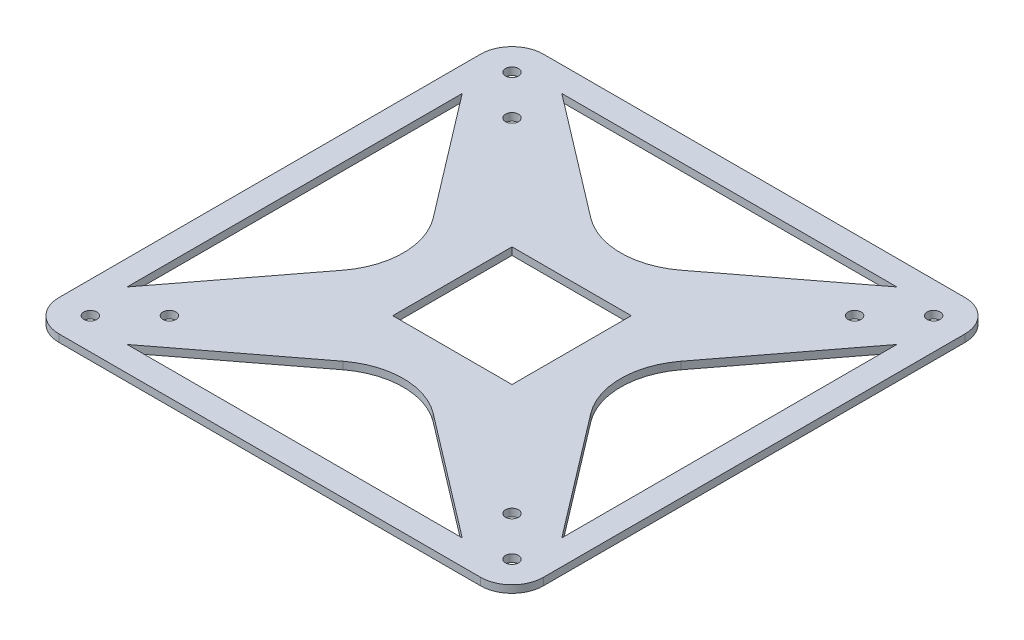
from build123d import *

# Parameters (mm, degrees)
SKETCH_1_R      = 1.75
SKETCH_1_W      = 32
SKETCH_1_H      = 32
EXTRUDE_1_DEPTH = 2


with BuildPart() as part:
    # 草图1 → 凸台-拉伸1 (new body)
    with BuildSketch(Plane(origin=(0, 0, 0), x_dir=(1, 0, 0), z_dir=(0, 1, 0))):
        with BuildLine():
            Line((-56.568542495, 65), (56.568542495, 65))
            ThreePointArc((56.568542495, 65), (62.530483272, 62.530483272), (65, 56.568542495))
            Line((65, 56.568542495), (65, -56.568542495))
            ThreePointArc((65, -56.568542495), (62.530483272, -62.530483272), (56.568542495, -65))
            Line((56.568542495, -65), (-56.568542495, -65))
            ThreePointArc((-56.568542495, -65), (-62.530483272, -62.530483272), (-65, -56.568542495))
            Line((-65, -56.568542495), (-65, 56.568542495))
            ThreePointArc((-65, 56.568542495), (-62.530483272, 62.530483272), (-56.568542495, 65))
        make_face()
        with Locations(Location((-56.568542495, 56.568542495, 0), (0, 0, 270))):
            Circle(SKETCH_1_R, mode=Mode.SUBTRACT)
        with Locations(Location((56.568542495, 56.568542495, 0), (0, 0, 270))):
            Circle(SKETCH_1_R, mode=Mode.SUBTRACT)
        with Locations(Location((56.568542495, -56.568542495, 0), (0, 0, 270))):
            Circle(SKETCH_1_R, mode=Mode.SUBTRACT)
        with Locations(Location((-56.568542495, -56.568542495, 0), (0, 0, 270))):
            Circle(SKETCH_1_R, mode=Mode.SUBTRACT)
        with Locations(Location((45.961940777, 45.961940777, 0), (0, 0, 270))):
            Circle(SKETCH_1_R, mode=Mode.SUBTRACT)
        with Locations(Location((45.961940777, -45.961940777, 0), (0, 0, 270))):
            Circle(SKETCH_1_R, mode=Mode.SUBTRACT)
        with Locations(Location((-45.961940777, -45.961940777, 0), (0, 0, 270))):
            Circle(SKETCH_1_R, mode=Mode.SUBTRACT)
        with Locations(Location((-45.961940777, 45.961940777, 0), (0, 0, 270))):
            Circle(SKETCH_1_R, mode=Mode.SUBTRACT)
        with BuildLine():
            Line((-12.13091169, 33.271867745), (-44.961628787, 58.318542495))
            Line((-44.961628787, 58.318542495), (44.961628787, 58.318542495))
            Line((44.961628787, 58.318542495), (12.13091169, 33.271867745))
            ThreePointArc((12.13091169, 33.271867745), (0, 29.172841978), (-12.13091169, 33.271867745))
        make_face(mode=Mode.SUBTRACT)
        with BuildLine():
            Line((33.271867745, 12.13091169), (58.318542495, 44.961628787))
            Line((58.318542495, 44.961628787), (58.318542495, -44.961628787))
            Line((58.318542495, -44.961628787), (33.271867745, -12.13091169))
            ThreePointArc((33.271867745, -12.13091169), (29.172841978, 0), (33.271867745, 12.13091169))
        make_face(mode=Mode.SUBTRACT)
        with BuildLine():
            Line((-33.271867745, 12.13091169), (-58.318542495, 44.961628787))
            Line((-58.318542495, 44.961628787), (-58.318542495, -44.961628787))
            Line((-58.318542495, -44.961628787), (-33.271867745, -12.13091169))
            ThreePointArc((-33.271867745, -12.13091169), (-29.172841978, 0), (-33.271867745, 12.13091169))
        make_face(mode=Mode.SUBTRACT)
        with BuildLine():
            Line((12.13091169, -33.271867745), (44.961628787, -58.318542495))
            Line((44.961628787, -58.318542495), (-44.961628787, -58.318542495))
            Line((-44.961628787, -58.318542495), (-12.13091169, -33.271867745))
            ThreePointArc((-12.13091169, -33.271867745), (0, -29.172841978), (12.13091169, -33.271867745))
        make_face(mode=Mode.SUBTRACT)
        Rectangle(SKETCH_1_W, SKETCH_1_H, mode=Mode.SUBTRACT)
    extrude(amount=EXTRUDE_1_DEPTH)


solid = part.part
